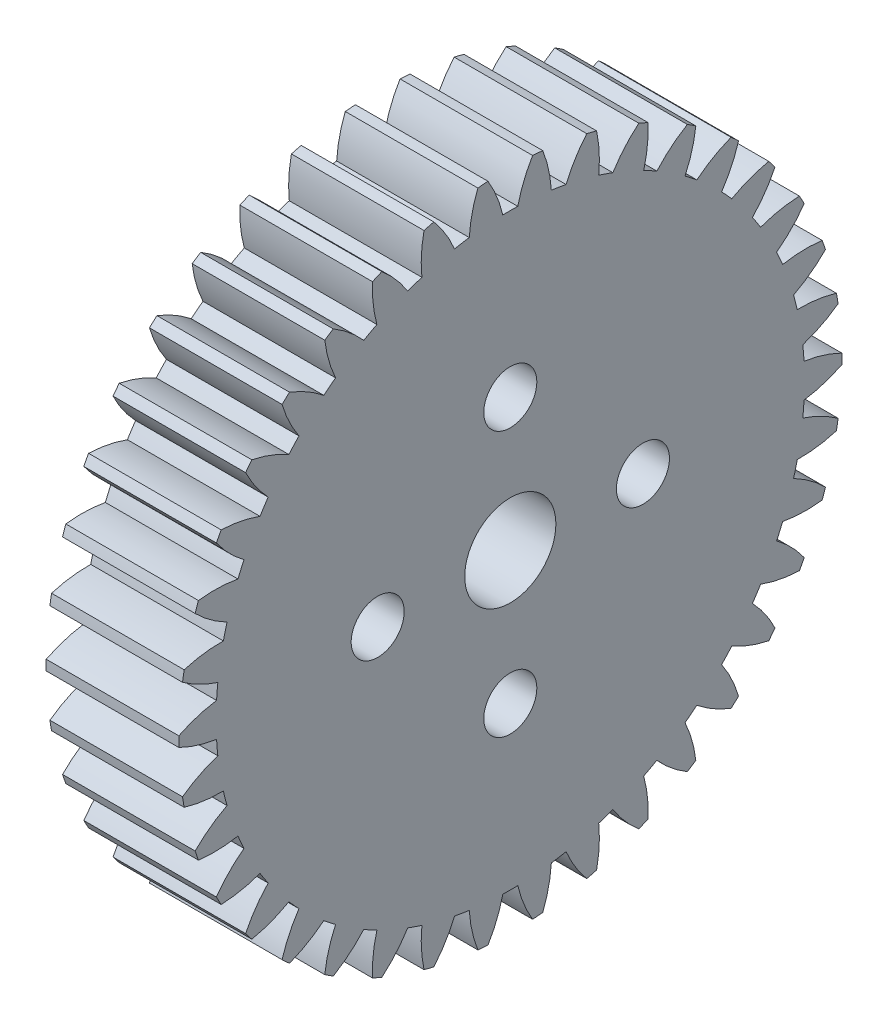
from build123d import *

# Parameters (mm, degrees)
BASPROSKE_W        = 10
BASPROSKE_H        = 20
TOOTHCUT_DEPTH     = 31
TEETHCUTS_COUNT    = 38
TEETHCUTS_ANGLE    = 350.526315789
BORSKE_R           = 0.4
BORE_DEPTH         = 50.0000508
SKETCH1_R          = 2.75
SKETCH1_R_2        = 1.6
CUT_EXTRUDE1_DEPTH = 30.969760362
SKETCH2_R          = 21.160648421
CUT_EXTRUDE2_DEPTH = 2


with BuildPart() as part:
    # BasProSke → Base-Revolve (revolve)
    with BuildSketch(Plane(origin=(0, 0, 0), x_dir=(1, 0, 0), z_dir=(0, 1, 0)), mode=Mode.PRIVATE) as base_revolve_sk:
        with Locations((5, 10)):
            Rectangle(BASPROSKE_W, BASPROSKE_H)
    revolve(base_revolve_sk.sketch.rotate(Axis((-10, 0, 0), (1, 0, 0)), 180), axis=Axis((-10, 0, 0), (1, 0, 0)))

    # TooCutSke → ToothCut (cut, through all)
    with BuildSketch(Plane(origin=(0, 0, 0), x_dir=(0, 0, -1), z_dir=(1, 0, 0))):
        with BuildLine():
            ThreePointArc((0.451522093, 17.743255868), (0, 17.749), (-0.451522093, 17.743255868))
            ThreePointArc((-0.451522093, 17.743255868), (-0.817150678, 18.897517772), (-1.361445068, 19.979066857))
            ThreePointArc((-1.361445068, 19.979066857), (0, 20.0254), (1.361445068, 19.979066857))
            ThreePointArc((1.361445068, 19.979066857), (0.817150678, 18.897517772), (0.451522093, 17.743255868))
        make_face()
    toothcut = extrude(amount=TOOTHCUT_DEPTH, mode=Mode.SUBTRACT)

    # TeethCuts: ToothCut ×38 about axis
    teethcuts_axis = Axis((-10, 0, 0), (1, 0, 0))
    for i in range(1, TEETHCUTS_COUNT):
        add(toothcut.rotate(teethcuts_axis, i * TEETHCUTS_ANGLE / (TEETHCUTS_COUNT - 1)), mode=Mode.SUBTRACT)

    # BorSke → Bore (cut, symmetric)
    with BuildSketch(Plane(origin=(0, 0, 0), x_dir=(0, 0, -1), z_dir=(1, 0, 0))):
        with Locations(Location((0, 0, 0), (0, 0, 180))):
            Circle(BORSKE_R)
    extrude(amount=BORE_DEPTH, both=True, mode=Mode.SUBTRACT)

    # Sketch1 → Cut-Extrude1 (cut, through all)
    with BuildSketch(Plane(origin=(10, 0, 0), x_dir=(0, 0, -1), z_dir=(1, 0, 0))):
        Circle(SKETCH1_R)
        with Locations((0, 8)):
            Circle(SKETCH1_R_2)
        with Locations((8, 0)):
            Circle(SKETCH1_R_2)
        with Locations((0, -8)):
            Circle(SKETCH1_R_2)
        with Locations((-8, 0)):
            Circle(SKETCH1_R_2)
    extrude(amount=-CUT_EXTRUDE1_DEPTH, mode=Mode.SUBTRACT)

    # Sketch2 → Cut-Extrude2 (cut)
    with BuildSketch(Plane.ZY):
        Circle(SKETCH2_R)
    extrude(amount=-CUT_EXTRUDE2_DEPTH, mode=Mode.SUBTRACT)


solid = part.part
